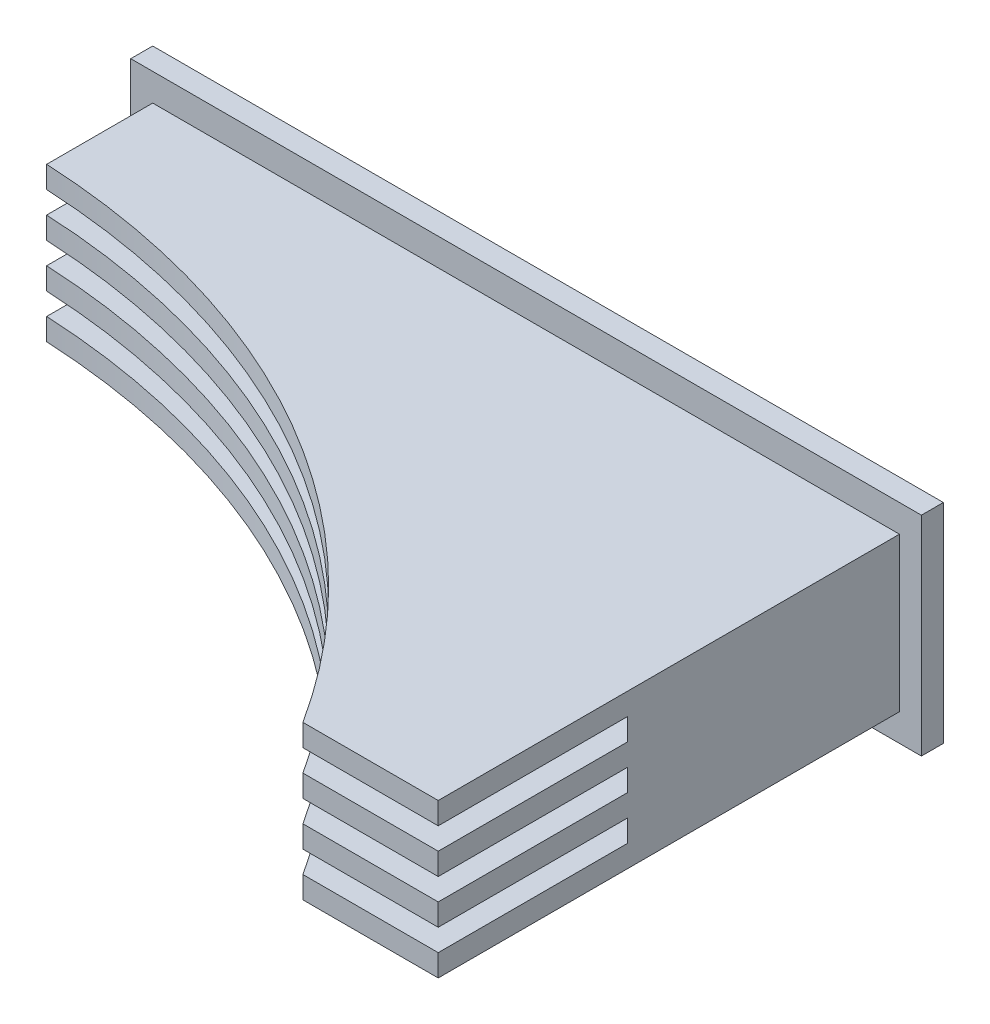
from build123d import *

# Parameters (mm, degrees)
SKETCH2_W               = 34
SKETCH2_H               = 1
EXTRUDE1_DEPTH          = 22
EXTRUDE1_2_DEPTH        = 22
EXTRUDE1_3_DEPTH        = 22
EXTRUDE1_4_DEPTH        = 22
CUT_EXTRUDE1_DEPTH      = 29.670542374
CUT_EXTRUDE1_DEPTH_BACK = 29.670542374
EXTRUDE2_DEPTH          = 1
EXTRUDE3_REACH          = 31.598


with BuildPart() as part:
    # Sketch2 → Extrude1 (new body)
    with BuildSketch(Plane.XY):
        with Locations((0, 13.75)):
            Rectangle(SKETCH2_W, SKETCH2_H)
    extrude(amount=EXTRUDE1_DEPTH)


with BuildPart() as body_2:
    # Sketch2 → Extrude1 2 (new body)
    with BuildSketch(Plane.XY):
        with Locations((0, 11.75)):
            Rectangle(SKETCH2_W, SKETCH2_H)
    extrude(amount=EXTRUDE1_2_DEPTH)


with BuildPart() as body_3:
    # Sketch2 → Extrude1 3 (new body)
    with BuildSketch(Plane.XY):
        with Locations((0, 9.75)):
            Rectangle(SKETCH2_W, SKETCH2_H)
    extrude(amount=EXTRUDE1_3_DEPTH)


with BuildPart() as body_4:
    # Sketch2 → Extrude1 4 (new body)
    with BuildSketch(Plane.XY):
        with Locations((0, 7.75)):
            Rectangle(SKETCH2_W, SKETCH2_H)
    extrude(amount=EXTRUDE1_4_DEPTH)


with BuildPart() as cut_extrude1_tool:
    # Sketch3 → Cut-Extrude1 (new, two sides: drawn at the far end of the back side and taken through both)
    with BuildSketch(Plane(origin=(0, 14.25, 0), x_dir=(1, 0, 0), z_dir=(0, 1, 0)).offset(-CUT_EXTRUDE1_DEPTH_BACK)):
        with BuildLine():
            Line((-102.195874551, -1.64205818), (-17, -5.829814285))
            ThreePointArc((-17, -5.829814285), (-1.114330758, -10.529941826), (10.839055861, -22))
            Line((10.839055861, -22), (56.687802572, -93.928900776))
            Line((56.687802572, -93.928900776), (-28.997329883, -241.446884233))
            Line((-28.997329883, -241.446884233), (-187.881007007, -149.160041637))
            Line((-187.881007007, -149.160041637), (-102.195874551, -1.64205818))
        make_face()
    extrude(amount=CUT_EXTRUDE1_DEPTH + CUT_EXTRUDE1_DEPTH_BACK)


with BuildPart() as part_1:
    add(part.part)

    # Cut-Extrude1: cut by cut_extrude1_tool
    add(cut_extrude1_tool.part, mode=Mode.SUBTRACT)



with BuildPart() as body_2_1:
    add(body_2.part)

    # Cut-Extrude1: cut by cut_extrude1_tool
    add(cut_extrude1_tool.part, mode=Mode.SUBTRACT)


with BuildPart() as body_3_1:
    add(body_3.part)

    # Cut-Extrude1: cut by cut_extrude1_tool
    add(cut_extrude1_tool.part, mode=Mode.SUBTRACT)


with BuildPart() as body_4_1:
    add(body_4.part)

    # Cut-Extrude1: cut by cut_extrude1_tool
    add(cut_extrude1_tool.part, mode=Mode.SUBTRACT)


with BuildPart() as part_2:
    add(part_1.part)

    add(body_2_1.part)  # Extrude2 merges body 2

    add(body_3_1.part)  # Extrude2 merges body 3

    add(body_4_1.part)  # Extrude2 merges body 4
    # Sketch1 → Extrude2 (add)
    with BuildSketch(Plane.XY):
        Polygon((-16, 6), (-18, 6), (-18, 15.5), (18, 15.5), (18, 6), (16, 6), align=None)
    extrude(amount=EXTRUDE2_DEPTH)

    # Extrude3: up to this face of the body (flat: up to its plane)
    extrude3_end = Plane(part_2.part.faces().sort_by_distance((4.784093831, 7.25, 8.43063068))[0])
    # Sketch4 → Extrude3 (add, up to the picked face)
    with BuildSketch(Plane(origin=(0, 14.25, 0), x_dir=(1, 0, 0), z_dir=(0, 1, 0)), mode=Mode.PRIVATE) as extrude3_sk1:
        with BuildLine():
            Line((17, -13.384444495), (17, -1))
            Line((17, -1), (2.315156907, -1))
            ThreePointArc((2.315156907, -1), (10.32529612, -6.40047667), (17, -13.384444495))
        make_face()
    extrude3_tool1 = split(extrude(extrude3_sk1.sketch, amount=-EXTRUDE3_REACH, mode=Mode.PRIVATE), bisect_by=extrude3_end, keep=Keep.BOTH, mode=Mode.PRIVATE)
    add(extrude3_tool1.solids().sort_by(Axis((12.478382, 14.25, 4.828977), (0, -1, 0)))[0])


solid = part_2.part
